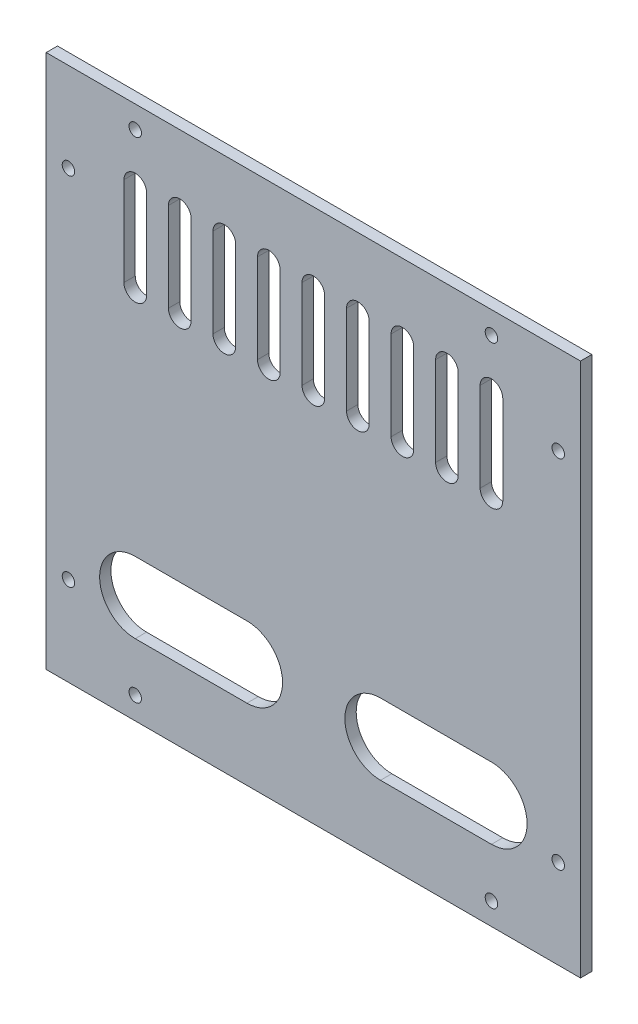
from build123d import *

# Parameters (mm, degrees)
SKETCH1_W           = 300
SKETCH1_H           = 300
BOSS_EXTRUDE1_DEPTH = 6.35
CUT_EXTRUDE1_DEPTH  = 6.35
CUT_EXTRUDE2_DEPTH  = 425.311586573
SKETCH4_R           = 3.5
CUT_EXTRUDE3_DEPTH  = 10


with BuildPart() as part:
    # Sketch1 → Boss-Extrude1 (new body)
    with BuildSketch(Plane.XY):
        with Locations((150, 150)):
            Rectangle(SKETCH1_W, SKETCH1_H)
    extrude(amount=BOSS_EXTRUDE1_DEPTH)

    # Sketch2 → Cut-Extrude1 (cut)
    with BuildSketch(Plane.XY.offset(6.35)):
        with BuildLine():
            Line((143.65, 210), (143.65, 260))
            ThreePointArc((143.65, 260), (150, 266.35), (156.35, 260))
            Line((156.35, 260), (156.35, 210))
            ThreePointArc((156.35, 210), (150, 203.65), (143.65, 210))
        make_face()
        with BuildLine():
            Line((181.35, 210), (181.35, 260))
            ThreePointArc((181.35, 260), (175, 266.35), (168.65, 260))
            Line((168.65, 260), (168.65, 210))
            ThreePointArc((168.65, 210), (175, 203.65), (181.35, 210))
        make_face()
        with BuildLine():
            Line((206.35, 210), (206.35, 260))
            ThreePointArc((206.35, 260), (200, 266.35), (193.65, 260))
            Line((193.65, 260), (193.65, 210))
            ThreePointArc((193.65, 210), (200, 203.65), (206.35, 210))
        make_face()
        with BuildLine():
            Line((231.35, 210), (231.35, 260))
            ThreePointArc((231.35, 260), (225, 266.35), (218.65, 260))
            Line((218.65, 260), (218.65, 210))
            ThreePointArc((218.65, 210), (225, 203.65), (231.35, 210))
        make_face()
        with BuildLine():
            Line((256.35, 210), (256.35, 260))
            ThreePointArc((256.35, 260), (250, 266.35), (243.65, 260))
            Line((243.65, 260), (243.65, 210))
            ThreePointArc((243.65, 210), (250, 203.65), (256.35, 210))
        make_face()
        with BuildLine():
            Line((131.35, 210), (131.35, 260))
            ThreePointArc((131.35, 260), (125, 266.35), (118.65, 260))
            Line((118.65, 260), (118.65, 210))
            ThreePointArc((118.65, 210), (125, 203.65), (131.35, 210))
        make_face()
        with BuildLine():
            Line((106.35, 210), (106.35, 260))
            ThreePointArc((106.35, 260), (100, 266.35), (93.65, 260))
            Line((93.65, 260), (93.65, 210))
            ThreePointArc((93.65, 210), (100, 203.65), (106.35, 210))
        make_face()
        with BuildLine():
            Line((81.35, 210), (81.35, 260))
            ThreePointArc((81.35, 260), (75, 266.35), (68.65, 260))
            Line((68.65, 260), (68.65, 210))
            ThreePointArc((68.65, 210), (75, 203.65), (81.35, 210))
        make_face()
        with BuildLine():
            Line((56.35, 210), (56.35, 260))
            ThreePointArc((56.35, 260), (50, 266.35), (43.65, 260))
            Line((43.65, 260), (43.65, 210))
            ThreePointArc((43.65, 210), (50, 203.65), (56.35, 210))
        make_face()
    extrude(amount=-CUT_EXTRUDE1_DEPTH, mode=Mode.SUBTRACT)

    # Sketch3 → Cut-Extrude2 (cut, through all)
    with BuildSketch(Plane.XY.offset(6.35)):
        with BuildLine():
            Line((50, 80), (112.708755261, 80))
            ThreePointArc((112.708755261, 80), (132.708755261, 60), (112.708755261, 40))
            Line((112.708755261, 40), (50, 40))
            ThreePointArc((50, 40), (30, 60), (50, 80))
        make_face()
        with BuildLine():
            Line((250, 40), (187.708755261, 40))
            ThreePointArc((187.708755261, 40), (167.708755261, 60), (187.708755261, 80))
            Line((187.708755261, 80), (250, 80))
            ThreePointArc((250, 80), (270, 60), (250, 40))
        make_face()
    extrude(amount=-CUT_EXTRUDE2_DEPTH, mode=Mode.SUBTRACT)

    # Sketch4 → Cut-Extrude3 (cut)
    with BuildSketch(Plane.XY.offset(6.35)):
        with Locations((50, 287.5)):
            Circle(SKETCH4_R)
        with Locations((250, 287.5)):
            Circle(SKETCH4_R)
        with Locations((12.5, 50)):
            Circle(SKETCH4_R)
        with Locations((12.5, 250)):
            Circle(SKETCH4_R)
        with Locations(Location((287.5, 50, 0), (0, 0, 180))):
            Circle(SKETCH4_R)
        with Locations(Location((287.5, 250, 0), (0, 0, 180))):
            Circle(SKETCH4_R)
        with Locations(Location((250, 12.5, 0), (0, 0, 180))):
            Circle(SKETCH4_R)
        with Locations(Location((50, 12.5, 0), (0, 0, 180))):
            Circle(SKETCH4_R)
    extrude(amount=-CUT_EXTRUDE3_DEPTH, mode=Mode.SUBTRACT)


solid = part.part
